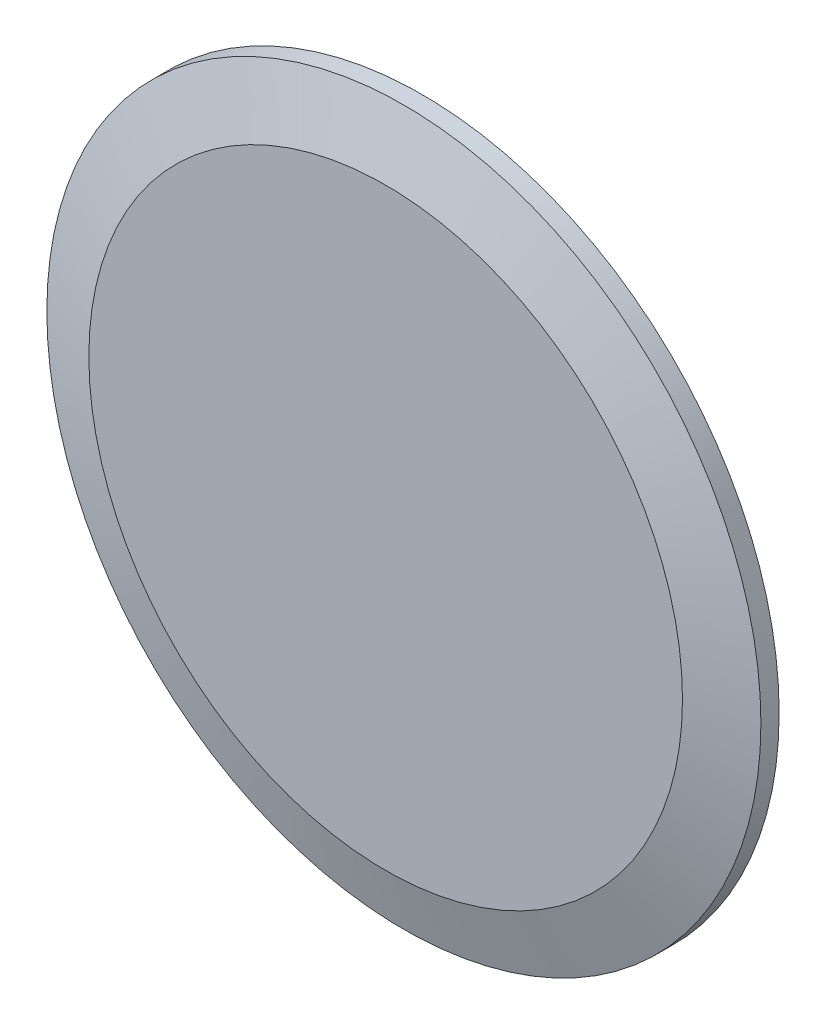
from build123d import *

# Parameters (mm, degrees)
CONTOUR_R                  = 21.05
BOSS_EXTRU_1_CONTOUR_DEPTH = 2.15


with BuildPart() as part:
    # Contour → Boss.-Extru.1_Contour (new body)
    with BuildSketch(Plane.XY):
        with Locations(Location((0, 0, 0), (0, 0, 180))):
            Circle(CONTOUR_R)
    extrude(amount=BOSS_EXTRU_1_CONTOUR_DEPTH)

    # Chanfrein_Bordure → Enlèvement de matière-Révolution1 (revolve, cut)
    with BuildSketch(Plane(origin=(0, 0, 0), x_dir=(1, 0, 0), z_dir=(0, 1, 0)), mode=Mode.PRIVATE) as enl_vement_de_mati_re_r_volution1_sk:
        Polygon((17.5, -2.15), (21.05, -1.075), (21.05, -2.15), align=None)
    revolve(enl_vement_de_mati_re_r_volution1_sk.sketch.rotate(Axis((0, 0, -0.1075), (0, 0, 1)), 180), axis=Axis((0, 0, -0.1075), (0, 0, 1)), mode=Mode.SUBTRACT)


solid = part.part
